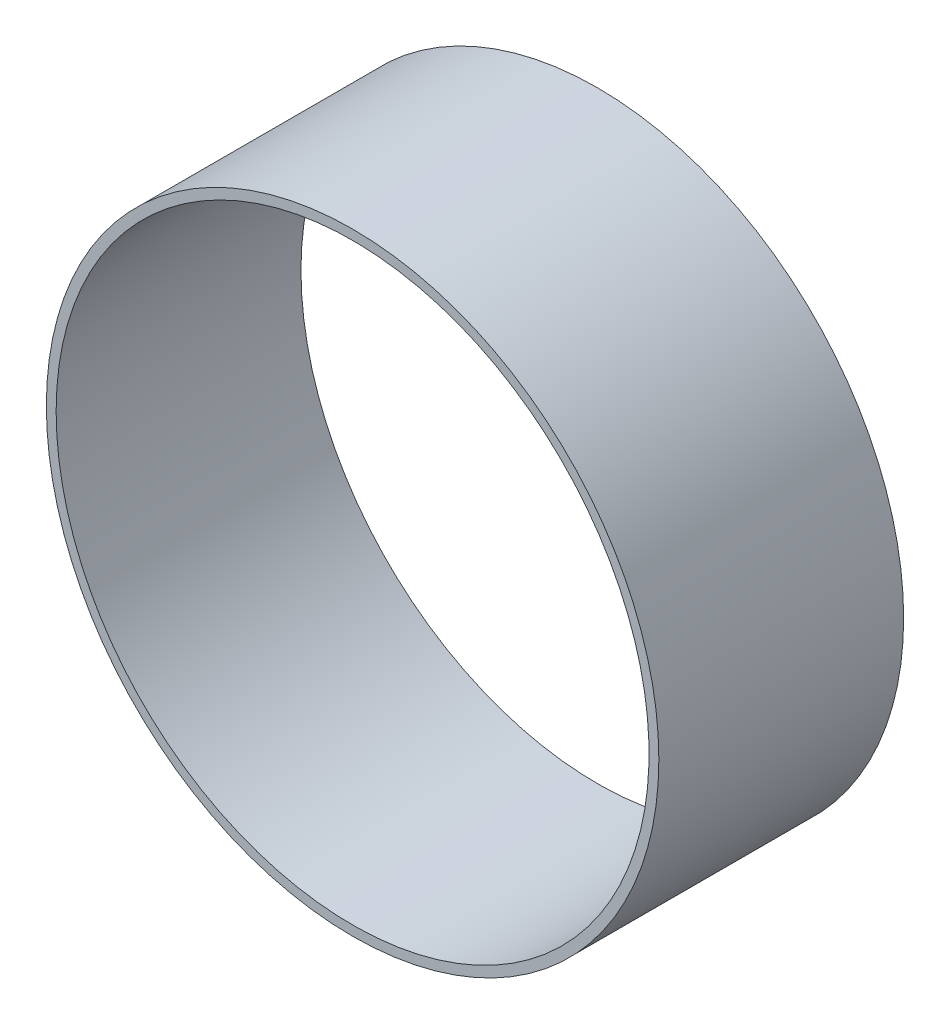
from build123d import *

# Parameters (mm, degrees)
SK_INSERT_SECTION_W = 1.27
SK_INSERT_SECTION_H = 31.75


with BuildPart() as part:
    # Sk_insert_section → Rev_insert (revolve)
    with BuildSketch(Plane(origin=(0, -19.05, 0), x_dir=(1, 0, 0), z_dir=(0, 1, 0)), mode=Mode.PRIVATE) as rev_insert_sk:
        with Locations((77.56525, 0)):
            Rectangle(SK_INSERT_SECTION_W, SK_INSERT_SECTION_H)
    revolve(rev_insert_sk.sketch.rotate(Axis((38.481, -19.05, -50.8), (0, 0, 1)), 180), axis=Axis((38.481, -19.05, -50.8), (0, 0, 1)))


solid = part.part
